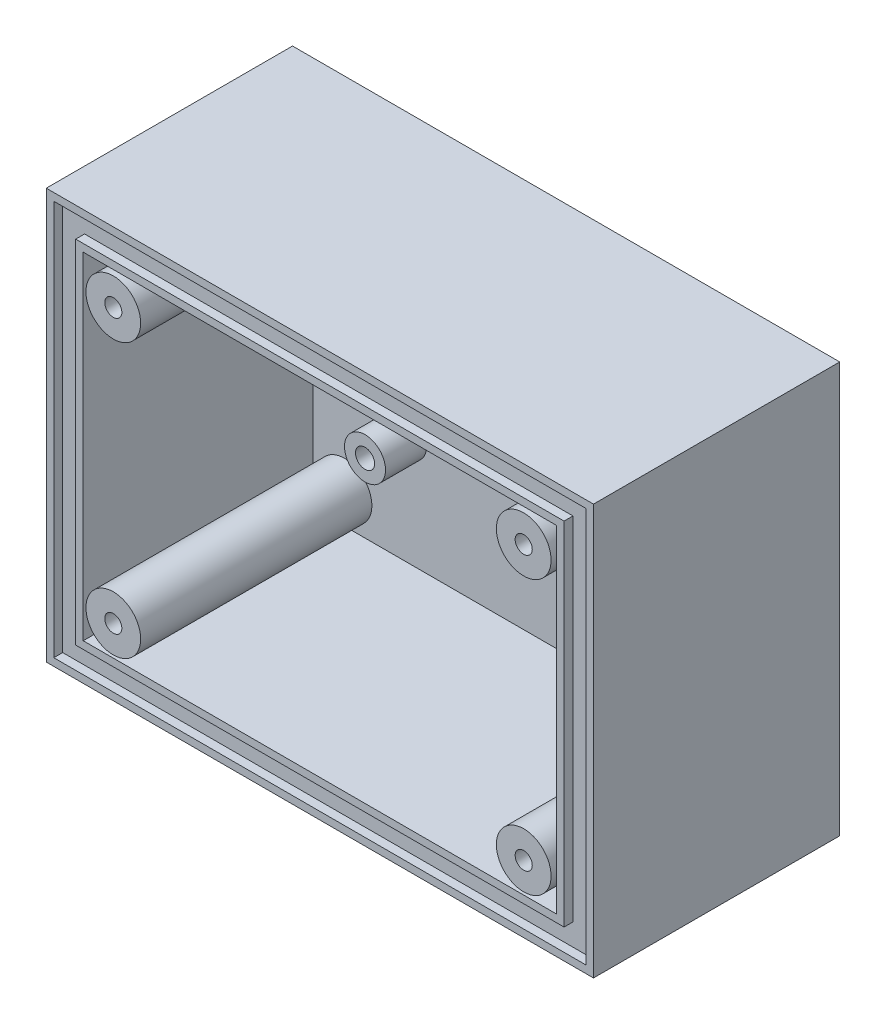
from build123d import *

# Parameters (mm, degrees)
SKETCH2_W              = 80
SKETCH2_H              = 60
FLOOR_2_DEPTH          = 2.4
LOWER_WALLS_START      = 2.4
SKETCH3_W              = 80
SKETCH3_H              = 60
SKETCH3_W_2            = 69.2
SKETCH3_H_2            = 49.2
LOWER_WALLS_DEPTH      = 32.3
OUTER_GROOVE_LIP_START = 34.7
SKETCH4_W              = 80
SKETCH4_H              = 60
SKETCH4_W_2            = 77.8
SKETCH4_H_2            = 57.8
OUTER_GROOVE_LIP_DEPTH = 1.3
INNER_GROOVE_LIP_START = 34.7
SKETCH5_W              = 71.4
SKETCH5_H              = 51.4
SKETCH5_W_2            = 69.2
SKETCH5_H_2            = 49.2
INNER_GROOVE_LIP_DEPTH = 1.3
SCREW_BOSS_START       = 2.4
SKETCH6_R              = 4
SKETCH6_R_2            = 1.25
SCREW_BOSS_DEPTH       = 33.8
BOSS_EXTRUDE6_START    = 2.4
SKETCH7_R              = 4
SKETCH7_R_2            = 1.25
BOSS_EXTRUDE6_DEPTH    = 33.8
BOSS_EXTRUDE7_START    = 2.4
SKETCH8_R              = 4
SKETCH8_R_2            = 1.25
BOSS_EXTRUDE7_DEPTH    = 33.8
BOSS_EXTRUDE8_START    = 2.4
SKETCH9_R              = 4
SKETCH9_R_2            = 1.25
BOSS_EXTRUDE8_DEPTH    = 33.8
PCB_POST_START         = 2.4
SKETCH10_R             = 3
SKETCH10_R_2           = 1.4
PCB_POST_DEPTH         = 6
BOSS_EXTRUDE10_START   = 2.4
SKETCH11_R             = 3
SKETCH11_R_2           = 1.4
BOSS_EXTRUDE10_DEPTH   = 6
BOSS_EXTRUDE11_START   = 2.4
SKETCH12_R             = 3
SKETCH12_R_2           = 1.4
BOSS_EXTRUDE11_DEPTH   = 6
BOSS_EXTRUDE12_START   = 2.4
SKETCH13_R             = 3
SKETCH13_R_2           = 1.4
BOSS_EXTRUDE12_DEPTH   = 6


with BuildPart() as part:
    # Sketch2 → Floor 2 (new body)
    with BuildSketch(Plane.XY):
        Rectangle(SKETCH2_W, SKETCH2_H)
    extrude(amount=FLOOR_2_DEPTH)

    # Sketch3 → Lower_walls (add)
    with BuildSketch(Plane.XY.offset(LOWER_WALLS_START)):
        Rectangle(SKETCH3_W, SKETCH3_H)
        Rectangle(SKETCH3_W_2, SKETCH3_H_2, mode=Mode.SUBTRACT)
    extrude(amount=LOWER_WALLS_DEPTH)

    # Sketch4 → Outer_groove_lip (add)
    with BuildSketch(Plane.XY.offset(OUTER_GROOVE_LIP_START)):
        Rectangle(SKETCH4_W, SKETCH4_H)
        Rectangle(SKETCH4_W_2, SKETCH4_H_2, mode=Mode.SUBTRACT)
    extrude(amount=OUTER_GROOVE_LIP_DEPTH)

    # Sketch5 → Inner_groove_lip (add)
    with BuildSketch(Plane.XY.offset(INNER_GROOVE_LIP_START)):
        Rectangle(SKETCH5_W, SKETCH5_H)
        Rectangle(SKETCH5_W_2, SKETCH5_H_2, mode=Mode.SUBTRACT)
    extrude(amount=INNER_GROOVE_LIP_DEPTH)

    # Sketch6 → Screw_boss (add)
    with BuildSketch(Plane.XY.offset(SCREW_BOSS_START)):
        with Locations(Location((-30, -20, 0), (0, 0, 180))):
            Circle(SKETCH6_R)
        with Locations((-30, -20)):
            Circle(SKETCH6_R_2, mode=Mode.SUBTRACT)
    extrude(amount=SCREW_BOSS_DEPTH)

    # Sketch7 → Boss-Extrude6 (add)
    with BuildSketch(Plane.XY.offset(BOSS_EXTRUDE6_START)):
        with Locations(Location((-30, 20, 0), (0, 0, 180))):
            Circle(SKETCH7_R)
        with Locations((-30, 20)):
            Circle(SKETCH7_R_2, mode=Mode.SUBTRACT)
    extrude(amount=BOSS_EXTRUDE6_DEPTH)

    # Sketch8 → Boss-Extrude7 (add)
    with BuildSketch(Plane.XY.offset(BOSS_EXTRUDE7_START)):
        with Locations(Location((30, -20, 0), (0, 0, 180))):
            Circle(SKETCH8_R)
        with Locations((30, -20)):
            Circle(SKETCH8_R_2, mode=Mode.SUBTRACT)
    extrude(amount=BOSS_EXTRUDE7_DEPTH)

    # Sketch9 → Boss-Extrude8 (add)
    with BuildSketch(Plane.XY.offset(BOSS_EXTRUDE8_START)):
        with Locations(Location((30, 20, 0), (0, 0, 180))):
            Circle(SKETCH9_R)
        with Locations((30, 20)):
            Circle(SKETCH9_R_2, mode=Mode.SUBTRACT)
    extrude(amount=BOSS_EXTRUDE8_DEPTH)

    # Sketch10 → PCB_post (add)
    with BuildSketch(Plane.XY.offset(PCB_POST_START)):
        with Locations(Location((-21, -8.5, 0), (0, 0, 180))):
            Circle(SKETCH10_R)
        with Locations((-21, -8.5)):
            Circle(SKETCH10_R_2, mode=Mode.SUBTRACT)
    extrude(amount=PCB_POST_DEPTH)

    # Sketch11 → Boss-Extrude10 (add)
    with BuildSketch(Plane.XY.offset(BOSS_EXTRUDE10_START)):
        with Locations(Location((-21, 8.5, 0), (0, 0, 180))):
            Circle(SKETCH11_R)
        with Locations((-21, 8.5)):
            Circle(SKETCH11_R_2, mode=Mode.SUBTRACT)
    extrude(amount=BOSS_EXTRUDE10_DEPTH)

    # Sketch12 → Boss-Extrude11 (add)
    with BuildSketch(Plane.XY.offset(BOSS_EXTRUDE11_START)):
        with Locations(Location((21, -8.5, 0), (0, 0, 180))):
            Circle(SKETCH12_R)
        with Locations((21, -8.5)):
            Circle(SKETCH12_R_2, mode=Mode.SUBTRACT)
    extrude(amount=BOSS_EXTRUDE11_DEPTH)

    # Sketch13 → Boss-Extrude12 (add)
    with BuildSketch(Plane.XY.offset(BOSS_EXTRUDE12_START)):
        with Locations(Location((21, 8.5, 0), (0, 0, 180))):
            Circle(SKETCH13_R)
        with Locations((21, 8.5)):
            Circle(SKETCH13_R_2, mode=Mode.SUBTRACT)
    extrude(amount=BOSS_EXTRUDE12_DEPTH)


solid = part.part
